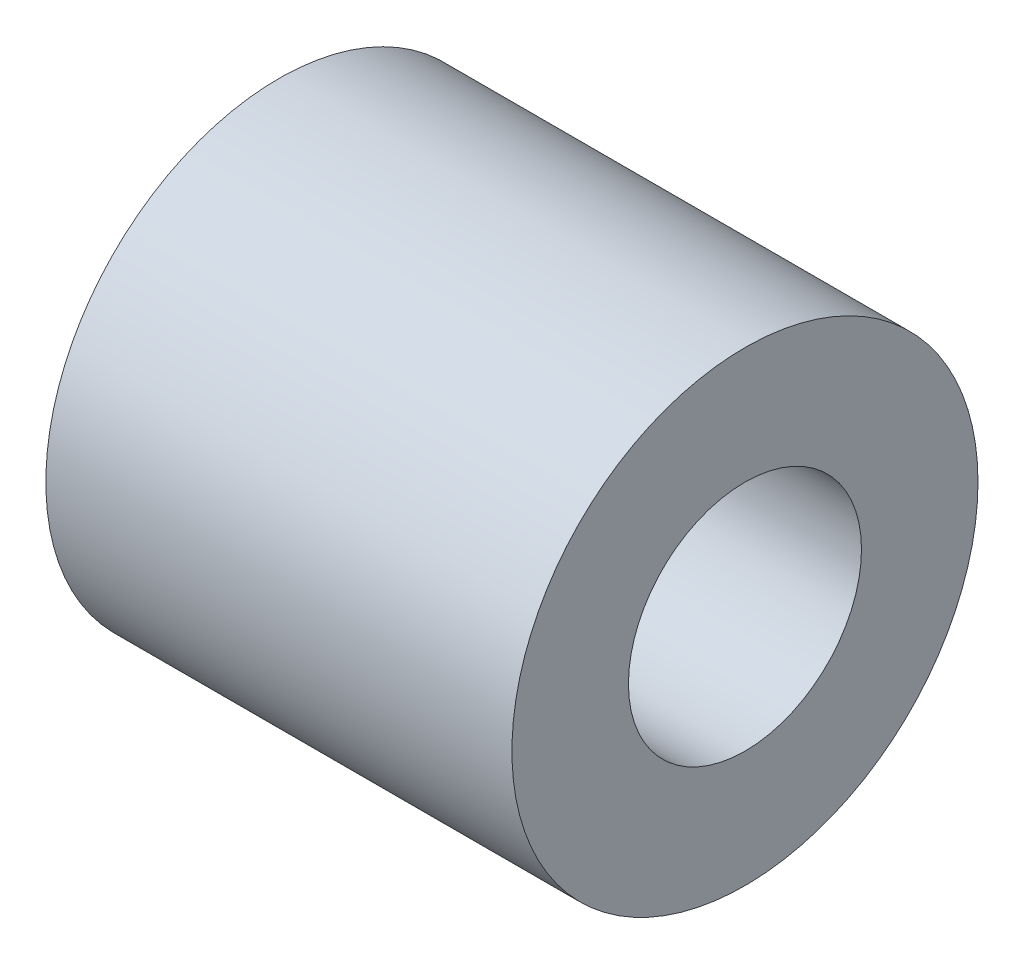
from build123d import *

# Parameters (mm, degrees)
SKETCH1_R           = 10
BOSS_EXTRUDE1_DEPTH = 2
SKETCH2_R           = 10
SKETCH2_R_2         = 5
BOSS_EXTRUDE2_DEPTH = 18


with BuildPart() as part:
    # Sketch1 → Boss-Extrude1 (new body)
    with BuildSketch(Plane(origin=(0, 0, 0), x_dir=(0, 0, -1), z_dir=(1, 0, 0))):
        Circle(SKETCH1_R)
    extrude(amount=BOSS_EXTRUDE1_DEPTH)

    # Sketch2 → Boss-Extrude2 (add)
    with BuildSketch(Plane(origin=(2, 0, 0), x_dir=(0, 0, -1), z_dir=(1, 0, 0))):
        Circle(SKETCH2_R)
        Circle(SKETCH2_R_2, mode=Mode.SUBTRACT)
    extrude(amount=BOSS_EXTRUDE2_DEPTH)


solid = part.part
